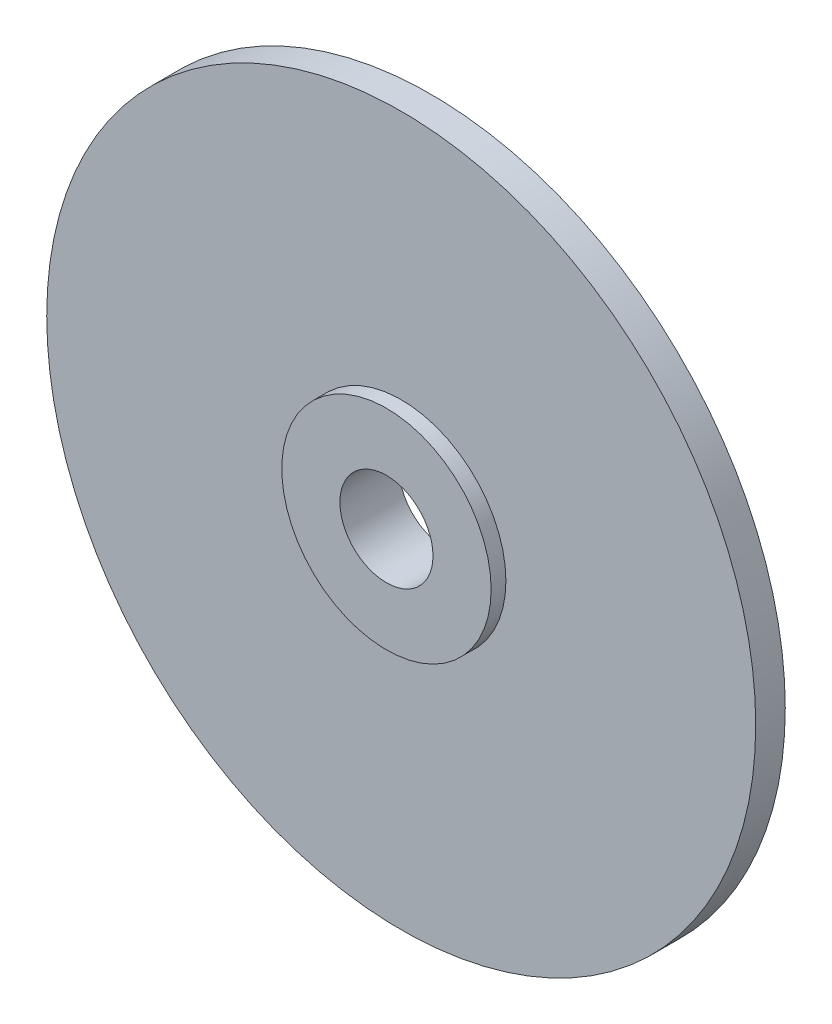
from build123d import *

# Parameters (mm, degrees)
SKETCH1_R           = 152.4
SKETCH1_R_2         = 20
BOSS_EXTRUDE1_DEPTH = 12.7
SKETCH2_R           = 45
SKETCH2_R_2         = 20
BOSS_EXTRUDE2_DEPTH = 6.35
BOSS_EXTRUDE3_START = 6.35
SKETCH3_R           = 45
SKETCH3_R_2         = 20
BOSS_EXTRUDE3_DEPTH = 6.35


with BuildPart() as part:
    # Sketch1 → Boss-Extrude1 (new body)
    with BuildSketch(Plane.XY):
        Circle(SKETCH1_R)
        Circle(SKETCH1_R_2, mode=Mode.SUBTRACT)
    extrude(amount=BOSS_EXTRUDE1_DEPTH)

    # Sketch2 → Boss-Extrude2 (add)
    with BuildSketch(Plane.XY.offset(12.7)):
        Circle(SKETCH2_R)
        Circle(SKETCH2_R_2, mode=Mode.SUBTRACT)
    extrude(amount=BOSS_EXTRUDE2_DEPTH)

    # Sketch3 → Boss-Extrude3 (add)
    with BuildSketch(Plane(origin=(0, 0, 0), x_dir=(-1, 0, 0), z_dir=(0, 0, -1)).offset(BOSS_EXTRUDE3_START)):
        with Locations(Location((0, 0, 0), (0, 0, 180))):
            Circle(SKETCH3_R)
        Circle(SKETCH3_R_2, mode=Mode.SUBTRACT)
    extrude(amount=-BOSS_EXTRUDE3_DEPTH)


solid = part.part
